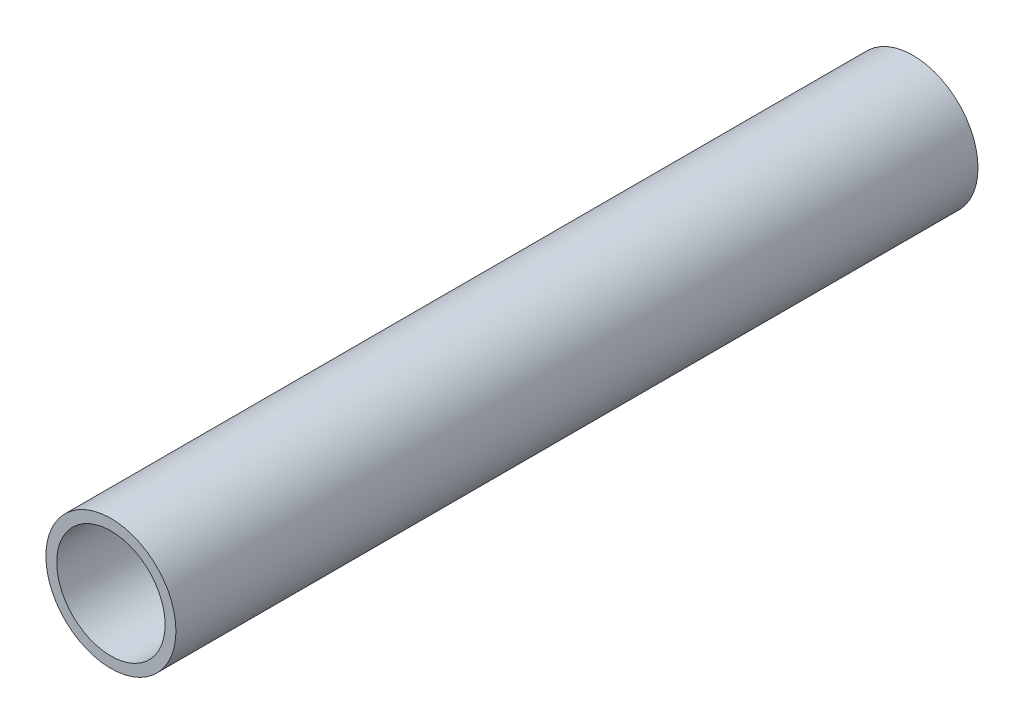
from build123d import *

# Parameters (mm, degrees)
SKETCH2_R           = 19.05
SKETCH2_R_2         = 15.875
BOSS_EXTRUDE1_DEPTH = 234.95


with BuildPart() as part:
    # Sketch2 → Boss-Extrude1 (new body)
    with BuildSketch(Plane.XY):
        Circle(SKETCH2_R)
        Circle(SKETCH2_R_2, mode=Mode.SUBTRACT)
    extrude(amount=BOSS_EXTRUDE1_DEPTH)


solid = part.part
